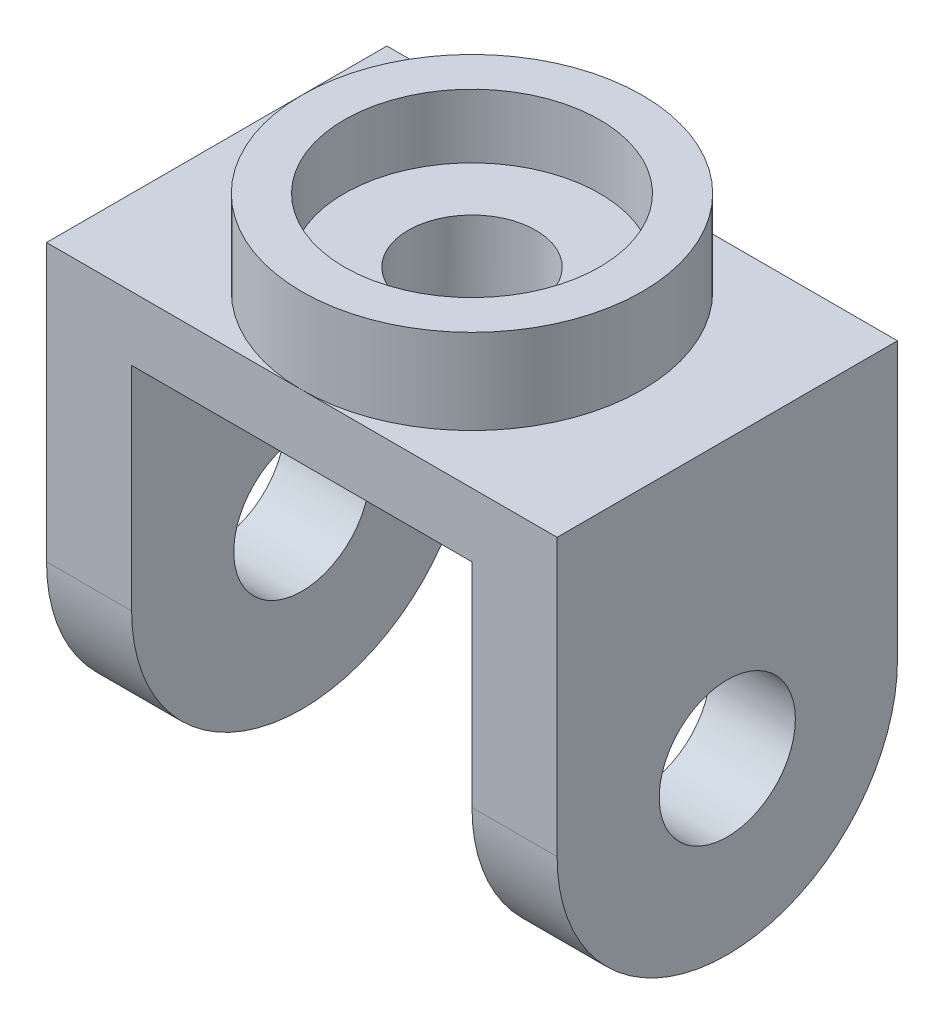
from build123d import *

# Parameters (mm, degrees)
SKETCH1_W           = 120
SKETCH1_H           = 80
BOSS_EXTRUDE1_DEPTH = 15
SKETCH2_R           = 40
BOSS_EXTRUDE2_DEPTH = 20
SKETCH3_R           = 30
CUT_EXTRUDE3_DEPTH  = 15
SKETCH4_R           = 15
CUT_EXTRUDE4_DEPTH  = 29
BOSS_EXTRUDE5_DEPTH = 20
SKETCH8_R           = 16
CUT_EXTRUDE6_DEPTH  = 20


with BuildPart() as part:
    # Sketch1 → Boss-Extrude1 (new body)
    with BuildSketch(Plane(origin=(0, 0, 0), x_dir=(1, 0, 0), z_dir=(0, 1, 0))):
        Rectangle(SKETCH1_W, SKETCH1_H)
    extrude(amount=BOSS_EXTRUDE1_DEPTH)

    # Sketch2 → Boss-Extrude2 (add)
    with BuildSketch(Plane(origin=(0, 15, 0), x_dir=(1, 0, 0), z_dir=(0, 1, 0))):
        with Locations(Location((0, 0, 0), (0, 0, 270))):
            Circle(SKETCH2_R)
    extrude(amount=BOSS_EXTRUDE2_DEPTH)

    # Sketch3 → Cut-Extrude3 (cut)
    with BuildSketch(Plane(origin=(0, 35, 0), x_dir=(1, 0, 0), z_dir=(0, 1, 0))):
        with Locations(Location((0, 0, 0), (0, 0, 270))):
            Circle(SKETCH3_R)
    extrude(amount=-CUT_EXTRUDE3_DEPTH, mode=Mode.SUBTRACT)

    # Sketch4 → Cut-Extrude4 (cut)
    with BuildSketch(Plane(origin=(0, 20, 0), x_dir=(1, 0, 0), z_dir=(0, 1, 0))):
        with Locations(Location((0, 0, 0), (0, 0, 270))):
            Circle(SKETCH4_R)
    extrude(amount=-CUT_EXTRUDE4_DEPTH, mode=Mode.SUBTRACT)

    # Sketch5 → Boss-Extrude5 (add)
    with BuildSketch(Plane(origin=(60, 0, 0), x_dir=(0, 0, -1), z_dir=(1, 0, 0))):
        with BuildLine():
            Line((-40, 0), (40, 0))
            Line((40, 0), (40, -50))
            ThreePointArc((40, -50), (0, -90), (-40, -50))
            Line((-40, -50), (-40, 0))
        make_face()
    boss_extrude5 = extrude(amount=-BOSS_EXTRUDE5_DEPTH)

    # Sketch8 → Cut-Extrude6 (cut)
    with BuildSketch(Plane(origin=(60, 0, 0), x_dir=(0, 0, -1), z_dir=(1, 0, 0))):
        with Locations((0, -50)):
            Circle(SKETCH8_R)
    cut_extrude6 = extrude(amount=-CUT_EXTRUDE6_DEPTH, mode=Mode.SUBTRACT)

    # Mirror1: Boss-Extrude5, Cut-Extrude6 across plane
    add(boss_extrude5.mirror(Plane(origin=(0, 0, 0), x_dir=(0, 0, 1), z_dir=(1, 0, 0))))
    add(cut_extrude6.mirror(Plane(origin=(0, 0, 0), x_dir=(0, 0, 1), z_dir=(1, 0, 0))), mode=Mode.SUBTRACT)


solid = part.part
